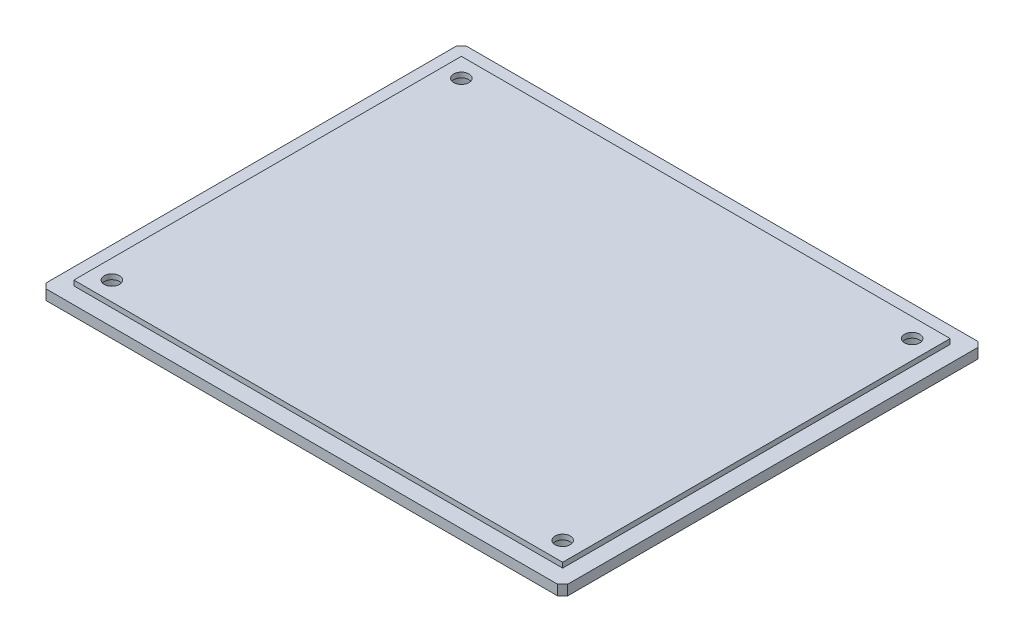
from build123d import *

# Parameters (mm, degrees)
SKETCH1_W           = 103
SKETCH1_H           = 83
BOSS_EXTRUDE1_DEPTH = 2
SKETCH2_W           = 96.5
SKETCH2_H           = 76.5
BOSS_EXTRUDE2_DEPTH = 1
CHAMFER1_SIZE       = 1
SKETCH3_R           = 1.5
CUT_EXTRUDE1_DEPTH  = 67.208005558
SKETCH5_R           = 2.8
CUT_EXTRUDE2_DEPTH  = 2


with BuildPart() as part:
    # Sketch1 → Boss-Extrude1 (new body)
    with BuildSketch(Plane(origin=(0, 0, 0), x_dir=(1, 0, 0), z_dir=(0, 1, 0))):
        Rectangle(SKETCH1_W, SKETCH1_H)
    extrude(amount=BOSS_EXTRUDE1_DEPTH)

    # Sketch2 → Boss-Extrude2 (add)
    with BuildSketch(Plane(origin=(0, 2, 0), x_dir=(1, 0, 0), z_dir=(0, 1, 0))):
        Rectangle(SKETCH2_W, SKETCH2_H)
    extrude(amount=BOSS_EXTRUDE2_DEPTH)

    # Chamfer1
    chamfer1_edges = [part.edges().sort_by_distance(p)[0] for p in [
        (51.5, 1, 41.5),
        (-51.5, 1, 41.5),
        (-51.5, 1, -41.5),
        (51.5, 1, -41.5),
    ]]
    chamfer(chamfer1_edges, length=CHAMFER1_SIZE)

    # Sketch3 → Cut-Extrude1 (cut, through all)
    with BuildSketch(Plane(origin=(0, 3, 0), x_dir=(1, 0, 0), z_dir=(0, 1, 0))):
        with Locations(Location((-44.5, 34.5, 0), (0, 0, 270))):
            Circle(SKETCH3_R)
        with Locations(Location((44.5, 34.5, 0), (0, 0, 270))):
            Circle(SKETCH3_R)
        with Locations(Location((44.5, -34.5, 0), (0, 0, 270))):
            Circle(SKETCH3_R)
        with Locations(Location((-44.5, -34.5, 0), (0, 0, 270))):
            Circle(SKETCH3_R)
    extrude(amount=-CUT_EXTRUDE1_DEPTH, mode=Mode.SUBTRACT)

    # Sketch5 → Cut-Extrude2 (cut)
    with BuildSketch(Plane.XZ):
        with Locations(Location((-44.5, 34.5, 0), (0, 0, 270))):
            Circle(SKETCH5_R)
        with Locations(Location((44.5, 34.5, 0), (0, 0, 270))):
            Circle(SKETCH5_R)
        with Locations(Location((44.5, -34.5, 0), (0, 0, 270))):
            Circle(SKETCH5_R)
        with Locations(Location((-44.5, -34.5, 0), (0, 0, 270))):
            Circle(SKETCH5_R)
    extrude(amount=-CUT_EXTRUDE2_DEPTH, mode=Mode.SUBTRACT)


solid = part.part
